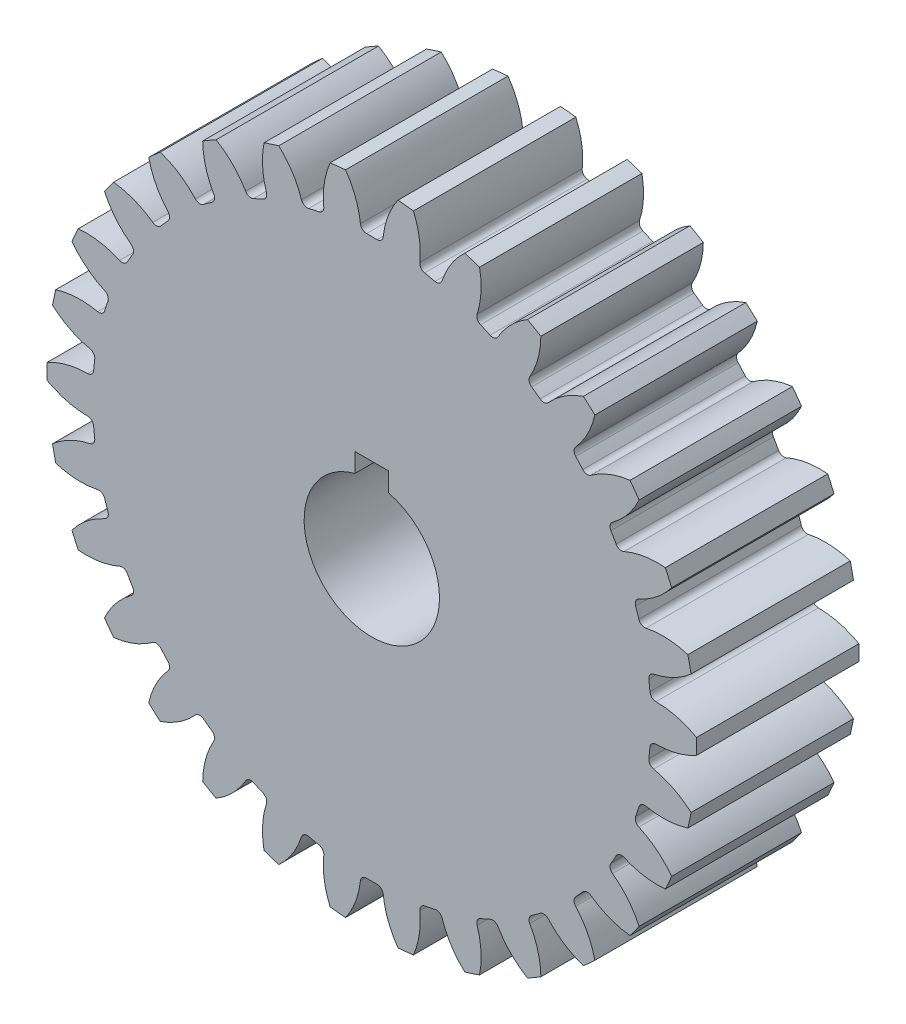
from build123d import *

# Parameters (mm, degrees)
SKETCH1_R                = 48
SKETCH1_R_2              = 41.25
DI_LI_KAL_NL_DEPTH       = 12
CUT_EXTRUDE1_DEPTH       = 12
FILLET1_R                = 0.9
CIRPATTERN1_COUNT        = 30
FILLET1_OF_CIRPATTERN1_R = 0.9
CUT_EXTRUDE2_DEPTH       = 24


with BuildPart() as part:
    # Sketch1 → dişli kalınlığı (new, symmetric)
    # profile 1 of 2: a face of its own
    with BuildSketch(Plane.XY):
        Circle(SKETCH1_R)
        Circle(SKETCH1_R_2, mode=Mode.SUBTRACT)
    # profile 2 of 2: a face of its own
    with BuildSketch(Plane.XY):
        Circle(SKETCH1_R_2)
    extrude(amount=DI_LI_KAL_NL_DEPTH, both=True)

    # Sketch2 → Cut-Extrude1 (cut, symmetric)
    with BuildSketch(Plane.XY):
        with BuildLine():
            ThreePointArc((4.614818005, -48.782204284), (2.47524483, -45.254750497), (1.623358928, -41.218044662))
            ThreePointArc((1.623358928, -41.218044662), (0, -41.25), (-1.623358928, -41.218044662))
            ThreePointArc((-1.623358928, -41.218044662), (-2.47524483, -45.254750497), (-4.614818005, -48.782204284))
            ThreePointArc((-4.614818005, -48.782204284), (0, -49), (4.614818005, -48.782204284))
        make_face()
    cut_extrude1 = extrude(amount=CUT_EXTRUDE1_DEPTH, both=True, mode=Mode.SUBTRACT)

    # Fillet1
    fillet1_edges = [part.edges().sort_by_distance(p)[0] for p in [
        (1.623358928, -41.218044662, 0),
        (-1.623358928, -41.218044662, 0),
    ]]
    fillet(fillet1_edges, radius=FILLET1_R)

    # CirPattern1: Cut-Extrude1 ×30 about axis
    cirpattern1_axis = Axis((0, 0, 0), (0, 0, 1))
    for i in range(1, CIRPATTERN1_COUNT):
        add(cut_extrude1.rotate(cirpattern1_axis, i * 360 / CIRPATTERN1_COUNT), mode=Mode.SUBTRACT)

    # Fillet1 of CirPattern1
    fillet1_of_cirpattern1_edges = [part.edges().sort_by_distance(p)[0] for p in [
        (10.157597999, -39.979816194, 0),
        (6.981828717, -40.654846793, 0),
        (18.247901295, -36.994277913, 0),
        (15.281876945, -38.314837035, 0),
        (25.540683742, -32.39191217, 0),
        (22.91403382, -34.300285044, 0),
        (31.717215751, -26.37386443, 0),
        (29.544737463, -28.786646005, 0),
        (36.507553236, -19.20315226, 0),
        (34.884194308, -22.014892402, 0),
        (39.702335462, -11.193170189, 0),
        (38.699044468, -14.280982363, 0),
        (41.161935115, -2.693992869, 0),
        (40.822560687, -5.922924866, 0),
        (40.822560687, 5.922924866, 0),
        (41.161935115, 2.693992869, 0),
        (38.699044468, 14.280982363, 0),
        (39.702335462, 11.193170189, 0),
        (34.884194308, 22.014892402, 0),
        (36.507553236, 19.20315226, 0),
        (29.544737463, 28.786646005, 0),
        (31.717215751, 26.37386443, 0),
        (22.91403382, 34.300285044, 0),
        (25.540683742, 32.39191217, 0),
        (15.281876945, 38.314837035, 0),
        (18.247901295, 36.994277913, 0),
        (6.981828717, 40.654846793, 0),
        (10.157597999, 39.979816194, 0),
        (-1.623358928, 41.218044662, 0),
        (1.623358928, 41.218044662, 0),
        (-10.157597999, 39.979816194, 0),
        (-6.981828717, 40.654846793, 0),
        (-18.247901295, 36.994277913, 0),
        (-15.281876945, 38.314837035, 0),
        (-25.540683742, 32.39191217, 0),
        (-22.91403382, 34.300285044, 0),
        (-31.717215751, 26.37386443, 0),
        (-29.544737463, 28.786646005, 0),
        (-36.507553236, 19.20315226, 0),
        (-34.884194308, 22.014892402, 0),
        (-39.702335462, 11.193170189, 0),
        (-38.699044468, 14.280982363, 0),
        (-41.161935115, 2.693992869, 0),
        (-40.822560687, 5.922924866, 0),
        (-40.822560687, -5.922924866, 0),
        (-41.161935115, -2.693992869, 0),
        (-38.699044468, -14.280982363, 0),
        (-39.702335462, -11.193170189, 0),
        (-34.884194308, -22.014892402, 0),
        (-36.507553236, -19.20315226, 0),
        (-29.544737463, -28.786646005, 0),
        (-31.717215751, -26.37386443, 0),
        (-22.91403382, -34.300285044, 0),
        (-25.540683742, -32.39191217, 0),
        (-15.281876945, -38.314837035, 0),
        (-18.247901295, -36.994277913, 0),
        (-6.981828717, -40.654846793, 0),
        (-10.157597999, -39.979816194, 0),
    ]]
    fillet(fillet1_of_cirpattern1_edges, radius=FILLET1_OF_CIRPATTERN1_R)

    # Sketch3 → Cut-Extrude2 (cut)
    with BuildSketch(Plane.XY.offset(12)):
        with BuildLine():
            Line((-2.5, 12.5), (2.5, 12.5))
            Line((2.5, 12.5), (2.5, 9.682458366))
            ThreePointArc((2.5, 9.682458366), (0, -10), (-2.5, 9.682458366))
            Line((-2.5, 9.682458366), (-2.5, 12.5))
        make_face()
    extrude(amount=-CUT_EXTRUDE2_DEPTH, mode=Mode.SUBTRACT)


solid = part.part
